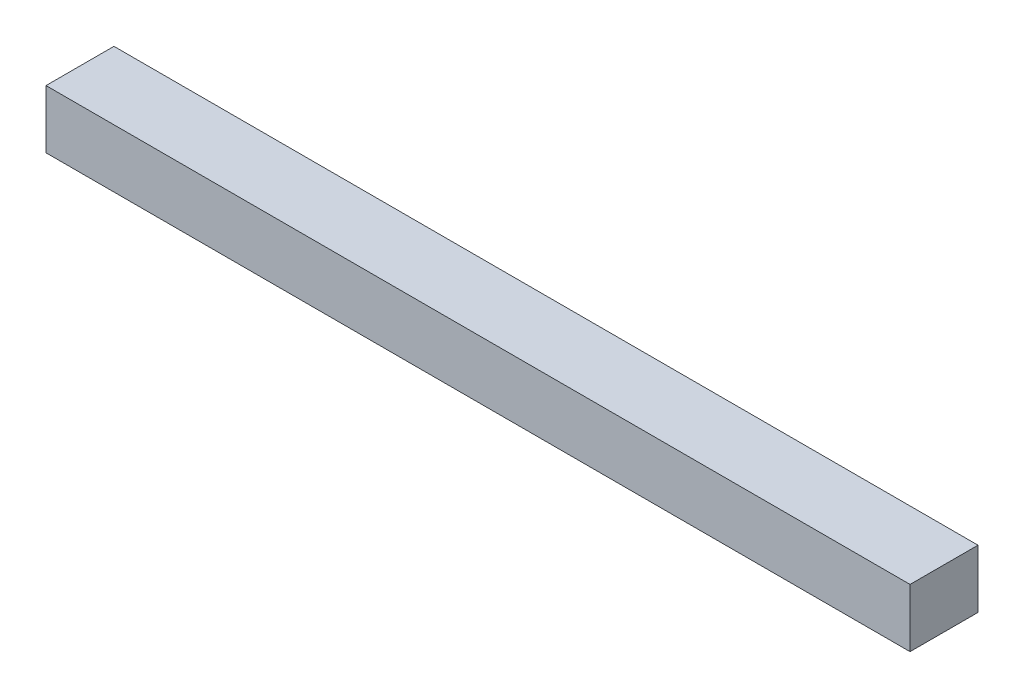
from build123d import *

# Parameters (mm, degrees)
BOSS_EXTRUDE1_DEPTH      = 1
BOSS_EXTRUDE1_DEPTH_BACK = 5
SKETCH1_W                = 89
SKETCH1_H                = 7


with BuildPart() as part:
    # Sketch1 → Boss-Extrude1 (new, two sides: drawn at the far end of the back side and taken through both)
    with BuildSketch(Plane(origin=(0, -4.235583409, 0), x_dir=(1, 0, 0), z_dir=(0, 1, 0)).offset(-BOSS_EXTRUDE1_DEPTH_BACK)):
        with Locations((217.970008794, -83.262189681)):
            Rectangle(SKETCH1_W, SKETCH1_H)
    extrude(amount=BOSS_EXTRUDE1_DEPTH + BOSS_EXTRUDE1_DEPTH_BACK)


solid = part.part
